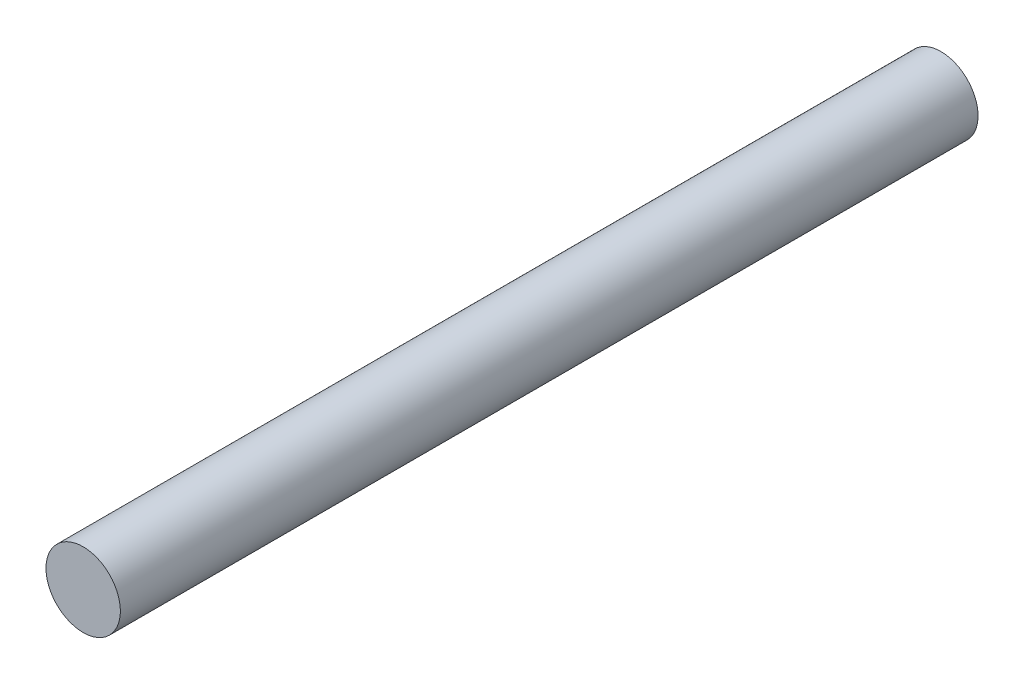
from build123d import *

# Parameters (mm, degrees)
SKETCH1_R           = 3.9
BOSS_EXTRUDE1_DEPTH = 90


with BuildPart() as part:
    # Sketch1 → Boss-Extrude1 (new body)
    with BuildSketch(Plane.XY):
        with Locations(Location((0, 0, 0), (0, 0, 180))):
            Circle(SKETCH1_R)
    extrude(amount=BOSS_EXTRUDE1_DEPTH)


solid = part.part
